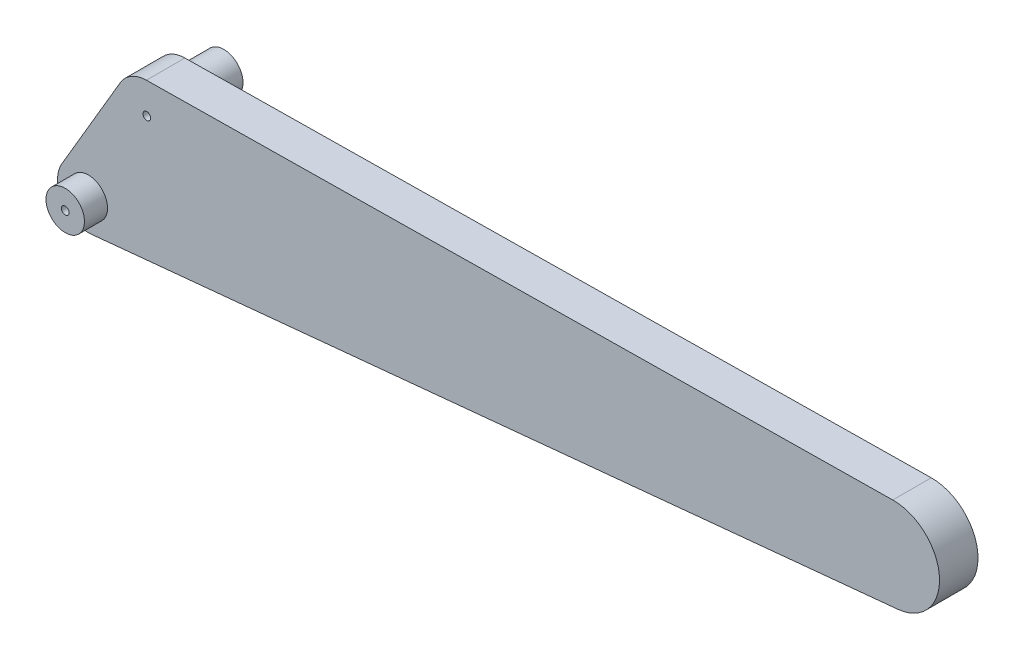
from build123d import *

# Parameters (mm, degrees)
SKETCH3_R           = 2.5
BOSS_EXTRUDE1_DEPTH = 5
BOSS_EXTRUDE2_START = -10
SKETCH4_R           = 2.5
SKETCH4_R_2         = 0.5
BOSS_EXTRUDE2_DEPTH = 10
SKETCH5_R           = 2.5
SKETCH5_R_2         = 0.5
BOSS_EXTRUDE3_DEPTH = 8


with BuildPart() as part:
    # Sketch3 → Boss-Extrude1 (new body)
    with BuildSketch(Plane.XY):
        with BuildLine():
            Line((-11.048388083, -10.905646279), (-3.448601602, 2.026609728))
            ThreePointArc((-3.448601602, 2.026609728), (-2.00903777, 3.458867913), (-0.051681177, 3.999666118))
            Line((-0.051681177, 3.999666118), (96.922478234, 5.252705394))
            ThreePointArc((96.922478234, 5.252705394), (102.990943647, -0.417257421), (97.580968918, -6.718600471))
            Line((97.580968918, -6.718600471), (-7.212473869, -16.913460466))
            ThreePointArc((-7.212473869, -16.913460466), (-10.971185359, -15.084852023), (-11.048388083, -10.905646279))
        make_face()
        with Locations((-7.599786481, -12.932256007)):
            Circle(SKETCH3_R, mode=Mode.SUBTRACT)
        Circle(SKETCH3_R, mode=Mode.SUBTRACT)
    extrude(amount=BOSS_EXTRUDE1_DEPTH)

    # Sketch4 → Boss-Extrude2 (add)
    with BuildSketch(Plane.XY.offset(5).offset(BOSS_EXTRUDE2_START)):
        Circle(SKETCH4_R)
        Circle(SKETCH4_R_2, mode=Mode.SUBTRACT)
    extrude(amount=BOSS_EXTRUDE2_DEPTH)

    # Sketch5 → Boss-Extrude3 (add)
    with BuildSketch(Plane(origin=(0, 0, 0), x_dir=(-1, 0, 0), z_dir=(0, 0, -1))):
        with Locations((7.599786481, -12.932256007)):
            Circle(SKETCH5_R)
        with Locations((7.599786481, -12.932256007)):
            Circle(SKETCH5_R_2, mode=Mode.SUBTRACT)
    extrude(amount=-BOSS_EXTRUDE3_DEPTH)


solid = part.part
